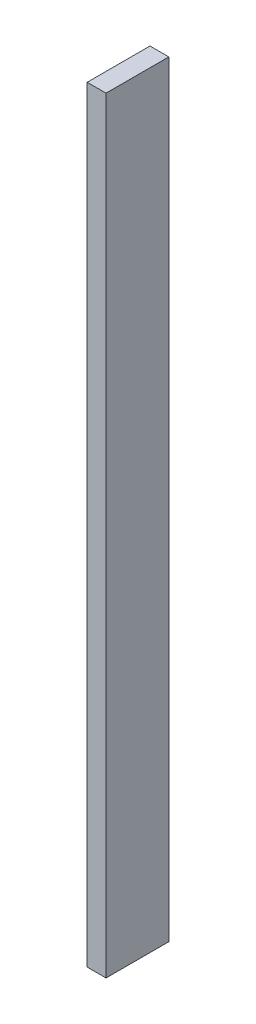
from build123d import *

# Parameters (mm, degrees)
SKETCH1_W           = 122
SKETCH1_H           = 3
BOSS_EXTRUDE1_DEPTH = 10


with BuildPart() as part:
    # Sketch1 → Boss-Extrude1 (new body)
    with BuildSketch(Plane(origin=(0, 0, 0), x_dir=(0, 1, 0), z_dir=(0, 0, 1))):
        Rectangle(SKETCH1_W, SKETCH1_H)
    extrude(amount=BOSS_EXTRUDE1_DEPTH)


solid = part.part
